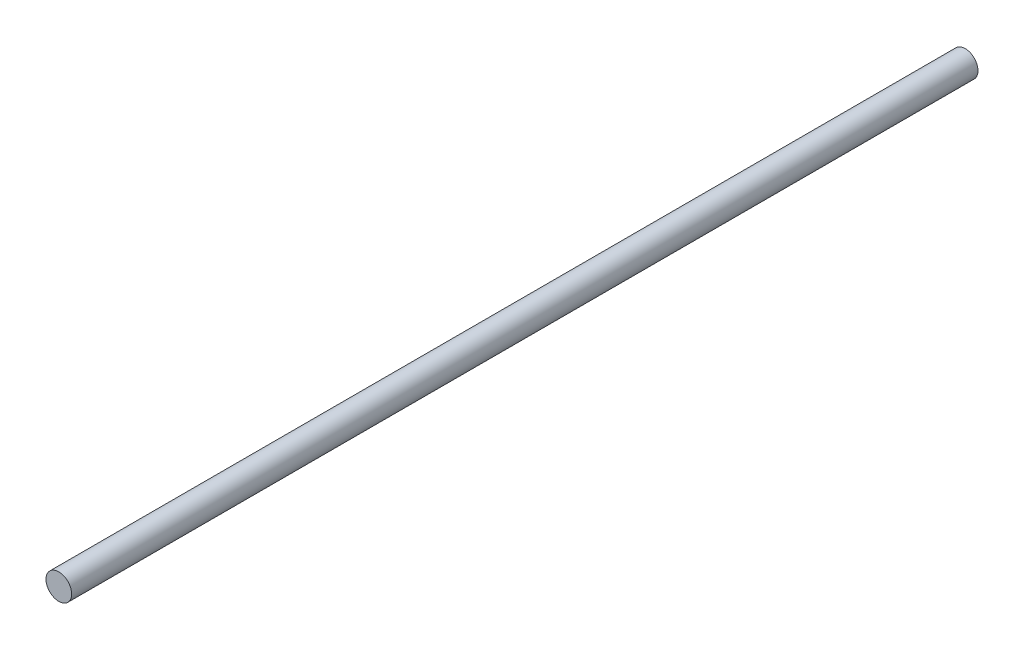
from build123d import *

# Parameters (mm, degrees)
SKETCH1_R           = 2.54
BOSS_EXTRUDE1_DEPTH = 179.54244


with BuildPart() as part:
    # Sketch1 → Boss-Extrude1 (new body)
    with BuildSketch(Plane.XY):
        Circle(SKETCH1_R)
    extrude(amount=BOSS_EXTRUDE1_DEPTH)


solid = part.part
